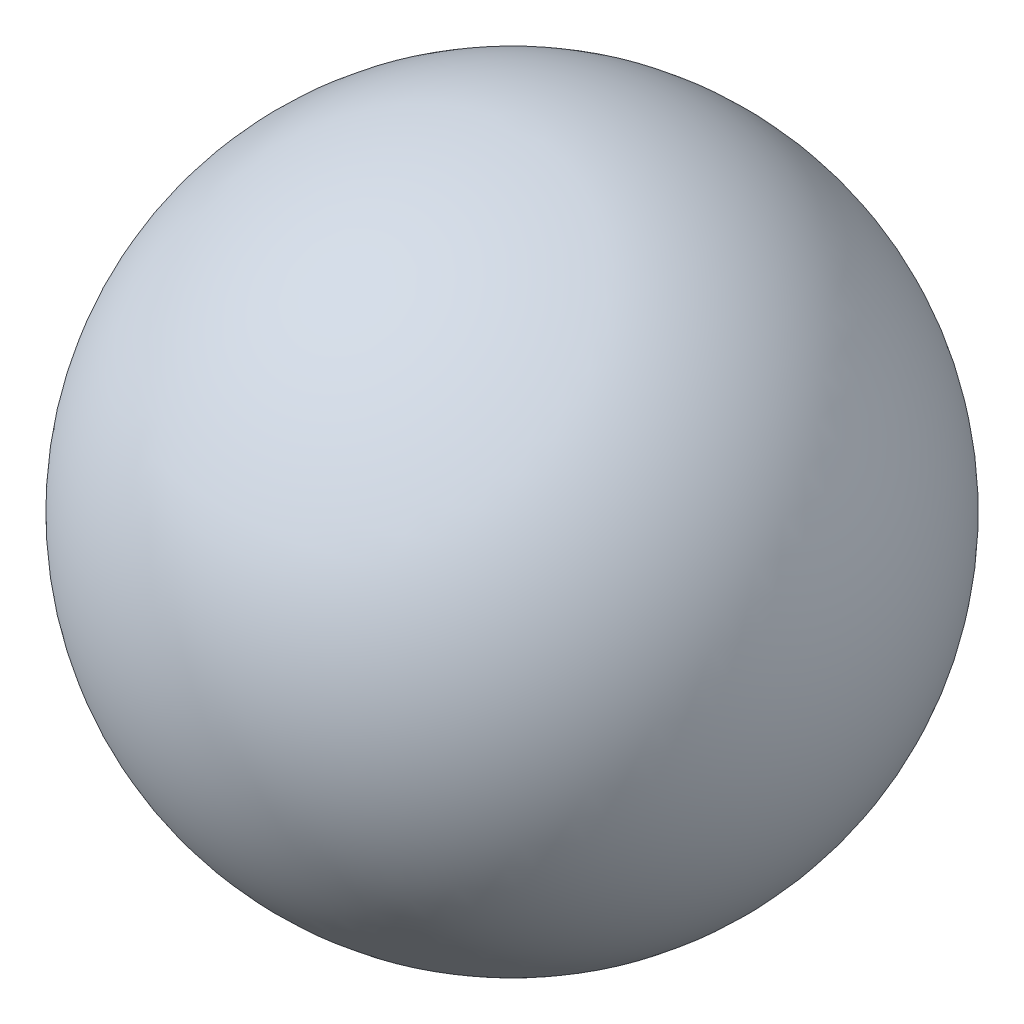
from build123d import *


with BuildPart() as part:
    # Sketch1 → Revolve1 (revolve)
    with BuildSketch(Plane.XY):
        with BuildLine():
            Line((0, 127), (0, -127))
            ThreePointArc((0, -127), (-127, 0), (0, 127))
        make_face()
    revolve(axis=Axis((0, 127, 0), (0, -1, 0)))


solid = part.part
